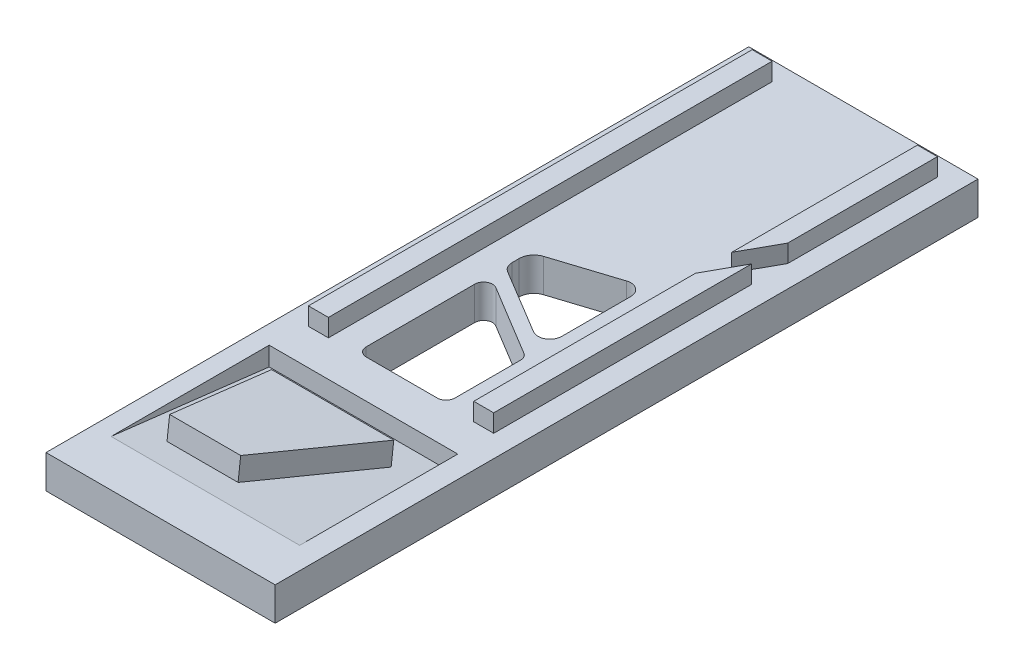
from build123d import *

# Parameters (mm, degrees)
SKETCH_1_W          = 10.65
SKETCH_1_H          = 32
EXTRUDE_1_DEPTH     = 1.5
CUT_EXTRUDE_START   = -1
CUT_EXTRUDE_1_DEPTH = 8.5
SKETCH_4_W          = 0.9
SKETCH_4_H          = 20
EXTRUDE_2_DEPTH     = 0.8
CUT_EXTRUDE_2_DEPTH = 5.8
CUT_EXTRUDE_3_DEPTH = 0.8
EXTRUDE_3_DEPTH     = 1
SKETCH_8_W          = 10.65
SKETCH_8_H          = 32
SKETCH_8_W_2        = 10.33
SKETCH_8_H_2        = 31.68
CUT_EXTRUDE_4_DEPTH = 10


with BuildPart() as part:
    # 草图1 → 凸台-拉伸1 (new body)
    with BuildSketch(Plane(origin=(0, 0, 0), x_dir=(1, 0, 0), z_dir=(0, 1, 0))):
        with Locations((5.325, -16)):
            Rectangle(SKETCH_1_W, SKETCH_1_H)
    extrude(amount=EXTRUDE_1_DEPTH)

    # 草图3 → 切除-拉伸1 (cut)
    with BuildSketch(Plane.ZY.offset(CUT_EXTRUDE_START)):
        Polygon((22.619658117, 1.5), (29.745922722, 1.5), (22.619658117, 0.65), align=None)
    extrude(amount=-CUT_EXTRUDE_1_DEPTH, mode=Mode.SUBTRACT)

    # 草图4 → 凸台-拉伸2 (add)
    with BuildSketch(Plane(origin=(0, 1.5, 0), x_dir=(1, 0, 0), z_dir=(0, 1, 0))):
        with Locations((1.6, -11)):
            Rectangle(SKETCH_4_W, SKETCH_4_H)
        with Locations((9.05, -11)):
            Rectangle(SKETCH_4_W, SKETCH_4_H)
    extrude(amount=EXTRUDE_2_DEPTH)

    # 草图5 → 切除-拉伸2 (cut)
    with BuildSketch(Plane(origin=(0, 1.5, 0), x_dir=(1, 0, 0), z_dir=(0, 1, 0))):
        with BuildLine():
            Line((3.25, -15.60411185), (3.25, -20.495209364))
            ThreePointArc((3.25, -20.495209364), (3.367157288, -20.778052076), (3.65, -20.895209364))
            Line((3.65, -20.895209364), (6.85, -20.895209364))
            ThreePointArc((6.85, -20.895209364), (7.132842712, -20.778052076), (7.25, -20.495209364))
            Line((7.25, -20.495209364), (7.25, -17.536917794))
            ThreePointArc((7.25, -17.536917794), (7.198369033, -17.340349696), (7.056804915, -17.194526604))
            Line((7.056804915, -17.194526604), (3.856804915, -15.261720659))
            ThreePointArc((3.856804915, -15.261720659), (3.453431902, -15.255742817), (3.25, -15.60411185))
        make_face()
        with BuildLine():
            Line((3.510326299, -14.380458294), (6.436346003, -16.139397213))
            ThreePointArc((6.436346003, -16.139397213), (6.977388991, -16.14656228), (7.25, -15.679162997))
            Line((7.25, -15.679162997), (7.25, -12.569402982))
            ThreePointArc((7.25, -12.569402982), (7.029399053, -12.135517868), (6.548846383, -12.05812148))
            Line((6.548846383, -12.05812148), (3.713121915, -12.968622573))
            ThreePointArc((3.713121915, -12.968622573), (3.378076137, -13.210716019), (3.25, -13.603731812))
            Line((3.25, -13.603731812), (3.25, -13.920224078))
            ThreePointArc((3.25, -13.920224078), (3.319590865, -14.184603216), (3.510326299, -14.380458294))
        make_face()
    extrude(amount=-CUT_EXTRUDE_2_DEPTH, mode=Mode.SUBTRACT)

    # 草图6 → 切除-拉伸3 (cut)
    with BuildSketch(Plane(origin=(0, 2.3, 0), x_dir=(1, 0, 0), z_dir=(0, 1, 0))):
        Polygon((9.5, -7.744189198), (8.6, -9.370124246), (8.6, -11), (9.5, -9.374064951), align=None)
    extrude(amount=-CUT_EXTRUDE_3_DEPTH, mode=Mode.SUBTRACT)

    # 草图7 → 凸台-拉伸3 (add)
    with BuildSketch(Plane(origin=(0, -2.01927835, 0.240853616), x_dir=(1, 0, 0), z_dir=(0, 0.9929615038625476, -0.11843754407715576))):
        Polygon((2.308389857, -23.863899052), (7.814564381, -23.863899052), (5.511982308, -28.494091265), (2.308389857, -28.494091265), align=None)
    extrude(amount=EXTRUDE_3_DEPTH)

    # 草图8 → 切除-拉伸4 (cut)
    with BuildSketch(Plane(origin=(0, 1.5, 0), x_dir=(1, 0, 0), z_dir=(0, 1, 0))):
        with Locations((5.325, -16)):
            Rectangle(SKETCH_8_W, SKETCH_8_H)
        with Locations((5.325, -16)):
            Rectangle(SKETCH_8_W_2, SKETCH_8_H_2, mode=Mode.SUBTRACT)
    extrude(amount=-CUT_EXTRUDE_4_DEPTH, mode=Mode.SUBTRACT)


solid = part.part
